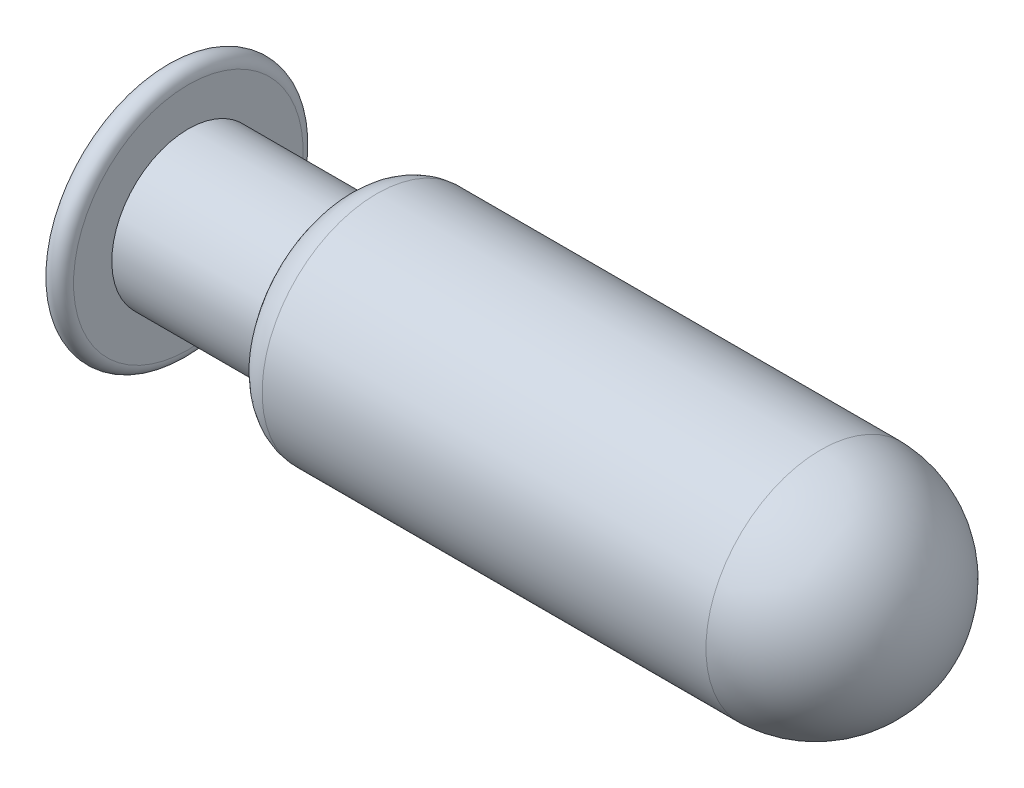
from build123d import *


with BuildPart() as part:
    # Sketch1 → Revolve1 (revolve)
    with BuildSketch(Plane.XY):
        with BuildLine():
            Line((0, 15), (0, 0))
            Line((0, 0), (100, 0))
            ThreePointArc((100, 0), (95.828314101, 10.380154803), (85.633651502, 14.986610216))
            Line((85.633651502, 14.986610216), (27.634324528, 14.986610216))
            ThreePointArc((27.634324528, 14.986610216), (24.337461443, 13.403793666), (23, 10))
            Line((23, 10), (3, 10))
            Line((3, 10), (3, 15))
            ThreePointArc((3, 15), (1.5, 16.5), (0, 15))
        make_face()
    revolve(axis=Axis((100, 0, 0), (-1, 0, 0)))


solid = part.part
